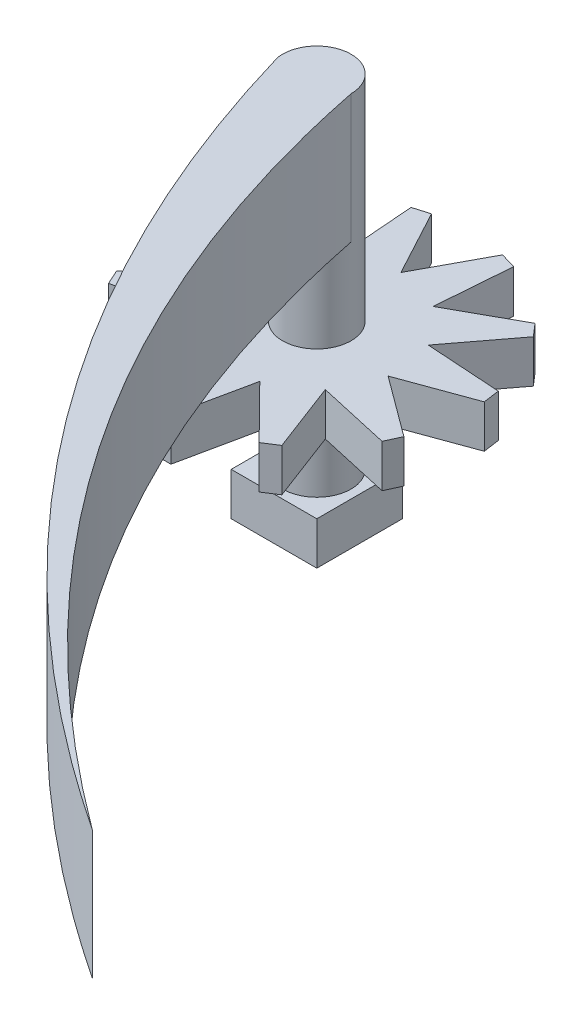
from build123d import *

# Parameters (mm, degrees)
ESQUISSE1_R        = 2
BOSS_EXTRU_1_DEPTH = 5
BOSS_EXTRU_2_DEPTH = 7.5
BOSS_EXTRU_3_DEPTH = 2.5
BOSS_EXTRU_4_START = 5
ESQUISSE5_R        = 2
BOSS_EXTRU_4_DEPTH = 5
ESQUISSE6_W        = 5
ESQUISSE6_H        = 5
BOSS_EXTRU_5_DEPTH = 2.5


with BuildPart() as part:
    # Esquisse1 → Boss.-Extru.1 (new body)
    with BuildSketch(Plane(origin=(0, 0, 0), x_dir=(1, 0, 0), z_dir=(0, 1, 0))):
        with Locations(Location((0, 0, 0), (0, 0, 270))):
            Circle(ESQUISSE1_R)
    extrude(amount=BOSS_EXTRU_1_DEPTH)

    # Esquisse2 → Boss.-Extru.2 (add)
    with BuildSketch(Plane(origin=(0, 5, 0), x_dir=(1, 0, 0), z_dir=(0, 1, 0))):
        with BuildLine():
            ThreePointArc((2, 0), (-0.157353741, 1.993800341), (-1.9752398, -0.313731942))
            add(Edge.make_bspline(
                [(-1.9752398, -0.313731942), (6.018007313, -27.755724693), (31.670728762, -44.785499484)],
                knots=[0, 0, 0, 1, 1, 1], degree=2))
            add(Edge.make_bspline(
                [(2, 0), (7.431064096, -26.884767596), (31.670728762, -44.785499484)],
                knots=[0, 0, 0, 1, 1, 1], degree=2))
        make_face()
    extrude(amount=BOSS_EXTRU_2_DEPTH)

    # Esquisse4 → Boss.-Extru.3 (add)
    with BuildSketch(Plane.XZ):
        Polygon((-0.480726256, 9.001048314), (0.480719689, 9.001048314), (1.384199773, 4.71416076), (4.461921977, 7.832061849), (5.270741775, 7.312264927), (3.713131196, 3.217447416), (7.987940467, 4.176450473), (8.387339547, 3.301888479), (4.863168658, 0.699216639), (8.977843256, -0.805155029), (8.841015231, -1.756814841), (4.46918339, -2.041011092), (7.117343203, -5.53113011), (6.487730005, -6.257742475), (2.65626293, -4.133232834), (2.99713593, -8.501011074), (2.0746353, -8.771881699), (-3.284e-06, -4.913182966), (-2.074641867, -8.771881699), (-2.997142497, -8.501011074), (-2.656269497, -4.133232834), (-6.487736572, -6.257742475), (-7.11734977, -5.53113011), (-4.469189957, -2.041011092), (-8.841021798, -1.756814841), (-8.977849823, -0.805155029), (-4.863175225, 0.699216639), (-8.387346114, 3.301888479), (-7.987947034, 4.176450473), (-3.713137763, 3.217447416), (-5.270748343, 7.312264927), (-4.461928544, 7.832061849), (-1.38420634, 4.71416076), align=None)
    extrude(amount=BOSS_EXTRU_3_DEPTH)

    # Esquisse5 → Boss.-Extru.4 (add)
    with BuildSketch(Plane.XZ.offset(2.5).offset(BOSS_EXTRU_4_START)):
        with Locations(Location((0, 0, 0), (0, 0, 270))):
            Circle(ESQUISSE5_R)
    extrude(amount=-BOSS_EXTRU_4_DEPTH)

    # Esquisse6 → Boss.-Extru.5 (add)
    with BuildSketch(Plane.XZ.offset(7.5)):
        Rectangle(ESQUISSE6_W, ESQUISSE6_H)
    extrude(amount=BOSS_EXTRU_5_DEPTH)


solid = part.part
